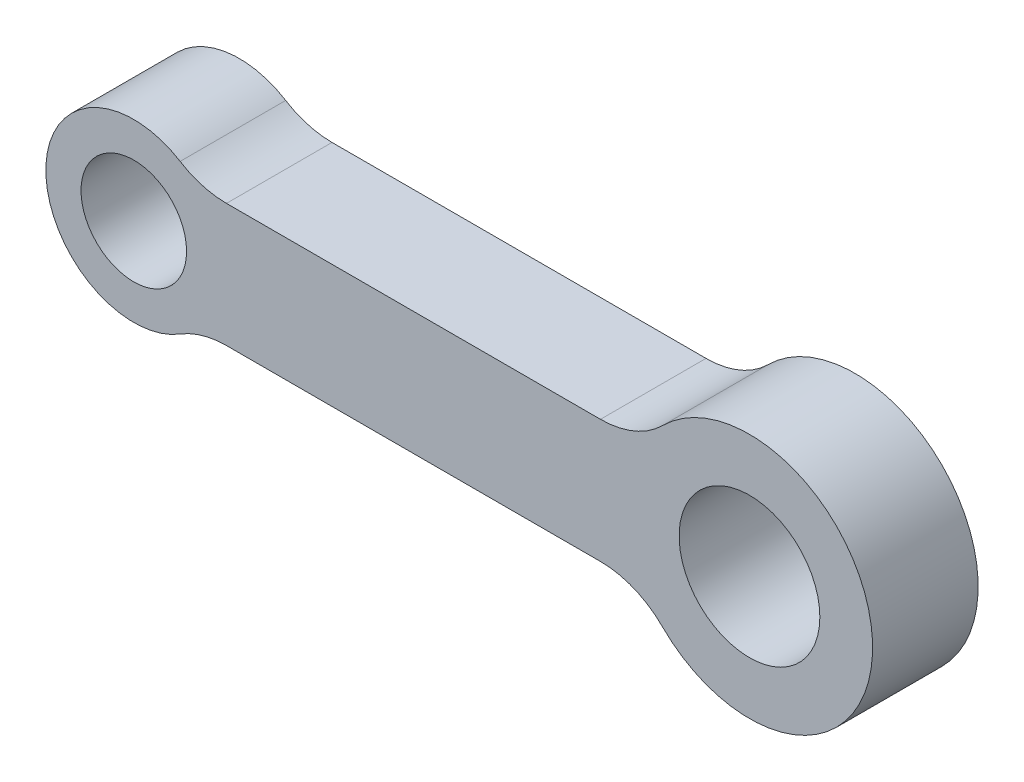
from build123d import *

# Parameters (mm, degrees)
BOSS_EXTRUDE1_DEPTH = 3
FILLET1_R           = 5


with BuildPart() as part:
    # Sketch3 → Boss-Extrude1 (new, symmetric)
    with BuildSketch(Plane.XY):
        with BuildLine():
            Line((11.437822174, 3.5), (-13.929285786, 3.5))
            ThreePointArc((-13.929285786, 3.5), (-12.871092404, 1.890294809), (-12.5, 0))
            ThreePointArc((-12.5, 0), (-12.871092404, -1.890294809), (-13.929285786, -3.5))
            Line((-13.929285786, -3.5), (11.437822174, -3.5))
            ThreePointArc((11.437822174, -3.5), (10.5, 0), (11.437822174, 3.5))
        make_face()
        with BuildLine():
            Line((-17.5, 3), (-17.5, 3.5))
            Line((-17.5, 3.5), (-13.929285786, 3.5))
            ThreePointArc((-13.929285786, 3.5), (-22.5, 0), (-13.929285786, -3.5))
            Line((-13.929285786, -3.5), (-17.5, -3.5))
            Line((-17.5, -3.5), (-17.5, -3))
            ThreePointArc((-17.5, -3), (-20.5, 0), (-17.5, 3))
        make_face()
        with BuildLine():
            Line((-13.929285786, 3.5), (-17.5, 3.5))
            Line((-17.5, 3.5), (-17.5, 3))
            ThreePointArc((-17.5, 3), (-15.378679656, 2.121320344), (-14.5, 0))
            ThreePointArc((-14.5, 0), (-15.378679656, -2.121320344), (-17.5, -3))
            Line((-17.5, -3), (-17.5, -3.5))
            Line((-17.5, -3.5), (-13.929285786, -3.5))
            ThreePointArc((-13.929285786, -3.5), (-12.871092404, -1.890294809), (-12.5, 0))
            ThreePointArc((-12.5, 0), (-12.871092404, 1.890294809), (-13.929285786, 3.5))
        make_face()
        with BuildLine():
            ThreePointArc((24.5, 0), (19.311733316, 6.761480784), (11.437822174, 3.5))
            Line((11.437822174, 3.5), (15.563508327, 3.5))
            ThreePointArc((15.563508327, 3.5), (19.531506006, 3.445719569), (21.5, 0))
            ThreePointArc((21.5, 0), (19.531506006, -3.445719569), (15.563508327, -3.5))
            Line((15.563508327, -3.5), (11.437822174, -3.5))
            ThreePointArc((11.437822174, -3.5), (19.311733316, -6.761480784), (24.5, 0))
        make_face()
        with BuildLine():
            Line((15.563508327, 3.5), (11.437822174, 3.5))
            ThreePointArc((11.437822174, 3.5), (10.5, 0), (11.437822174, -3.5))
            Line((11.437822174, -3.5), (15.563508327, -3.5))
            ThreePointArc((15.563508327, -3.5), (13.5, 0), (15.563508327, 3.5))
        make_face()
    extrude(amount=BOSS_EXTRUDE1_DEPTH, both=True)

    # Fillet1
    fillet1_edges = [part.edges().sort_by_distance(p)[0] for p in [
        (-13.929285786, 3.5, 0),
        (11.437822174, 3.5, 0),
        (11.437822174, -3.5, 0),
        (-13.929285786, -3.5, 0),
    ]]
    fillet(fillet1_edges, radius=FILLET1_R)


solid = part.part
